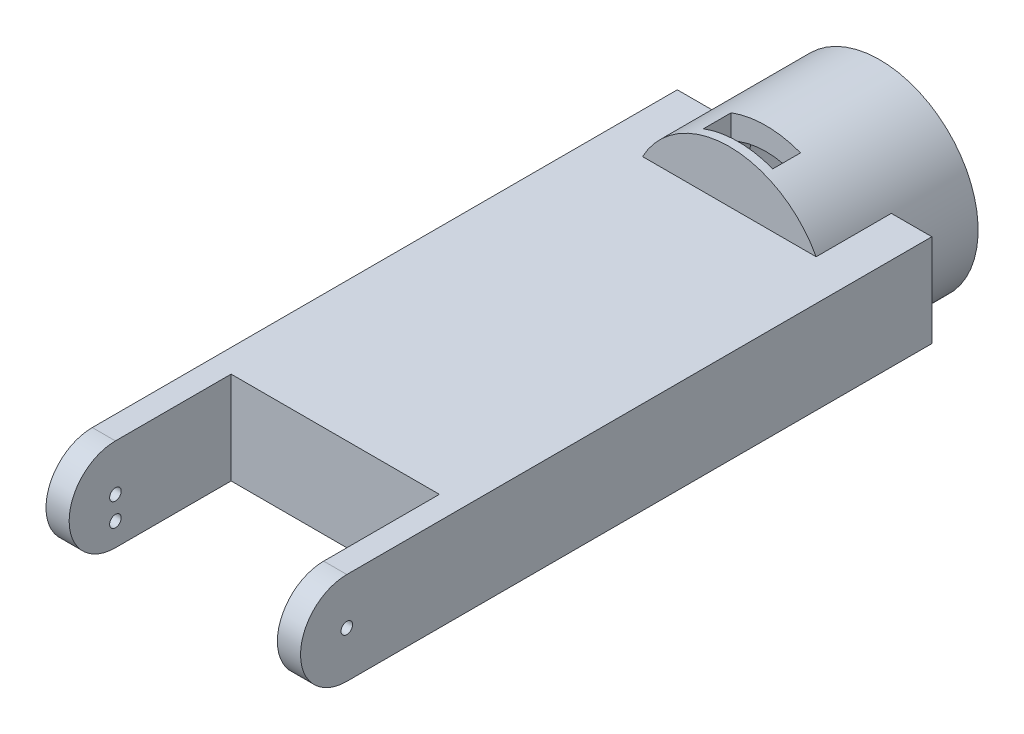
from build123d import *

# Parameters (mm, degrees)
EXTRUDE_1_DEPTH           = 110
CUT_EXTRUDE_2_DEPTH       = 304.47981811
CUT_EXTRUDE_2_DEPTH_BACK  = 304.47981811
SKETCH_2_W                = 90
SKETCH_2_H                = 70
CUT_EXTRUDE_3_DEPTH       = 302.496268634
CUT_EXTRUDE_3_DEPTH_BACK  = 302.496268634
SKETCH_3_R                = 2.5
CUT_EXTRUDE_4_DEPTH       = 302.496268634
CUT_EXTRUDE_4_DEPTH_BACK  = 302.496268634
SKETCH_4_W                = 29.668274831
SKETCH_4_H                = 40
SKETCH_5_R                = 42.5
EXTRUDE_2_DEPTH           = 32.5
SKETCH_6_R                = 38.01
CUT_EXTRUDE_6_DEPTH       = 23.7
SKETCH_7_R                = 32.8
CUT_EXTRUDE_7_DEPTH       = 38.3
SKETCH_9_R                = 1.25
CUT_EXTRUDE_8_DEPTH       = 5
CUT_EXTRUDE_11_DEPTH      = 320.469803837
CUT_EXTRUDE_11_DEPTH_BACK = 320.469803837
SKETCH_10_W               = 30
SKETCH_10_H               = 12
SKETCH_12_R               = 2.5
CUT_EXTRUDE_13_DEPTH      = 10


with BuildPart() as part:
    # 草图1 → 凸台-拉伸1 (new body)
    with BuildSketch(Plane(origin=(0, 0, 0), x_dir=(0, 0, -1), z_dir=(1, 0, 0))):
        with BuildLine():
            Line((0, 20), (260, 20))
            ThreePointArc((260, 20), (280, 0), (260, -20))
            Line((260, -20), (0, -20))
            ThreePointArc((0, -20), (-20, 0), (0, 20))
        make_face()
    extrude(amount=EXTRUDE_1_DEPTH)

    # 草图2 → 切除-拉伸2 (cut, two sides: drawn at the far end of the back side and taken through both)
    with BuildSketch(Plane(origin=(0, 20, 0), x_dir=(1, 0, 0), z_dir=(0, 1, 0)).offset(-CUT_EXTRUDE_2_DEPTH_BACK)):
        with Locations((55, 15)):
            Rectangle(SKETCH_2_W, SKETCH_2_H)
    extrude(amount=CUT_EXTRUDE_2_DEPTH + CUT_EXTRUDE_2_DEPTH_BACK, mode=Mode.SUBTRACT)

    # 草图3 → 切除-拉伸3 (cut, two sides: drawn at the far end of the back side and taken through both)
    with BuildSketch(Plane.ZY.offset(-CUT_EXTRUDE_3_DEPTH_BACK)):
        Circle(SKETCH_3_R)
    extrude(amount=CUT_EXTRUDE_3_DEPTH + CUT_EXTRUDE_3_DEPTH_BACK, mode=Mode.SUBTRACT)

    # 草图4 → 切除-拉伸4 (cut, two sides: drawn at the far end of the back side and taken through both)
    with BuildSketch(Plane(origin=(110, 0, 0), x_dir=(0, 0, -1), z_dir=(1, 0, 0)).offset(-CUT_EXTRUDE_4_DEPTH_BACK)):
        with Locations((267.649236146, 0)):
            Rectangle(SKETCH_4_W, SKETCH_4_H)
    extrude(amount=CUT_EXTRUDE_4_DEPTH + CUT_EXTRUDE_4_DEPTH_BACK, mode=Mode.SUBTRACT)

    # 草图5 → 凸台-拉伸2 (add, symmetric)
    with BuildSketch(Plane(origin=(0, 0, -252.81509873), x_dir=(-1, 0, 0), z_dir=(0, 0, -1))):
        with Locations(Location((-55, 0, 0), (0, 0, 151.927513064))):
            Circle(SKETCH_5_R)
    extrude(amount=EXTRUDE_2_DEPTH, both=True)

    # 草图6 → 切除-拉伸6 (cut)
    with BuildSketch(Plane(origin=(0, 0, -285.31509873), x_dir=(-1, 0, 0), z_dir=(0, 0, -1))):
        with Locations((-55, 0)):
            Circle(SKETCH_6_R)
    extrude(amount=-CUT_EXTRUDE_6_DEPTH, mode=Mode.SUBTRACT)

    # 草图7 → 切除-拉伸7 (cut)
    with BuildSketch(Plane(origin=(0, 0, -261.61509873), x_dir=(-1, 0, 0), z_dir=(0, 0, -1))):
        with Locations((-55, 0)):
            Circle(SKETCH_7_R)
    extrude(amount=-CUT_EXTRUDE_7_DEPTH, mode=Mode.SUBTRACT)

    # 草图9 → 切除-拉伸8 (cut)
    with BuildSketch(Plane(origin=(0, 0, -261.61509873), x_dir=(-1, 0, 0), z_dir=(0, 0, -1))):
        with Locations((-55, 34.5)):
            Circle(SKETCH_9_R)
        with Locations((-41.797421583, 31.873843872)):
            Circle(SKETCH_9_R)
        with Locations((-30.604816049, 24.395183951)):
            Circle(SKETCH_9_R)
        with Locations((-23.126156128, 13.202578417)):
            Circle(SKETCH_9_R)
        with Locations((-20.5, 0)):
            Circle(SKETCH_9_R)
        with Locations((-23.126156128, -13.202578417)):
            Circle(SKETCH_9_R)
        with Locations((-30.604816049, -24.395183951)):
            Circle(SKETCH_9_R)
        with Locations((-41.797421583, -31.873843872)):
            Circle(SKETCH_9_R)
        with Locations((-55, -34.5)):
            Circle(SKETCH_9_R)
        with Locations((-68.202578417, -31.873843872)):
            Circle(SKETCH_9_R)
        with Locations((-79.395183951, -24.395183951)):
            Circle(SKETCH_9_R)
        with Locations((-86.873843872, -13.202578417)):
            Circle(SKETCH_9_R)
        with Locations((-89.5, 0)):
            Circle(SKETCH_9_R)
        with Locations((-86.873843872, 13.202578417)):
            Circle(SKETCH_9_R)
        with Locations((-79.395183951, 24.395183951)):
            Circle(SKETCH_9_R)
        with Locations((-68.202578417, 31.873843872)):
            Circle(SKETCH_9_R)
    extrude(amount=-CUT_EXTRUDE_8_DEPTH, mode=Mode.SUBTRACT)

    # 草图10 → 切除-拉伸11 (cut, two sides: drawn at the far end of the back side and taken through both)
    with BuildSketch(Plane(origin=(0, 50, 0), x_dir=(1, 0, 0), z_dir=(0, 1, 0)).offset(-CUT_EXTRUDE_11_DEPTH_BACK)):
        with Locations((55, 230.078307714)):
            Rectangle(SKETCH_10_W, SKETCH_10_H)
    extrude(amount=CUT_EXTRUDE_11_DEPTH + CUT_EXTRUDE_11_DEPTH_BACK, mode=Mode.SUBTRACT)

    # 草图12 → 切除-拉伸13 (cut)
    with BuildSketch(Plane.ZY):
        with Locations((0, -10)):
            Circle(SKETCH_12_R)
    extrude(amount=-CUT_EXTRUDE_13_DEPTH, mode=Mode.SUBTRACT)


solid = part.part
